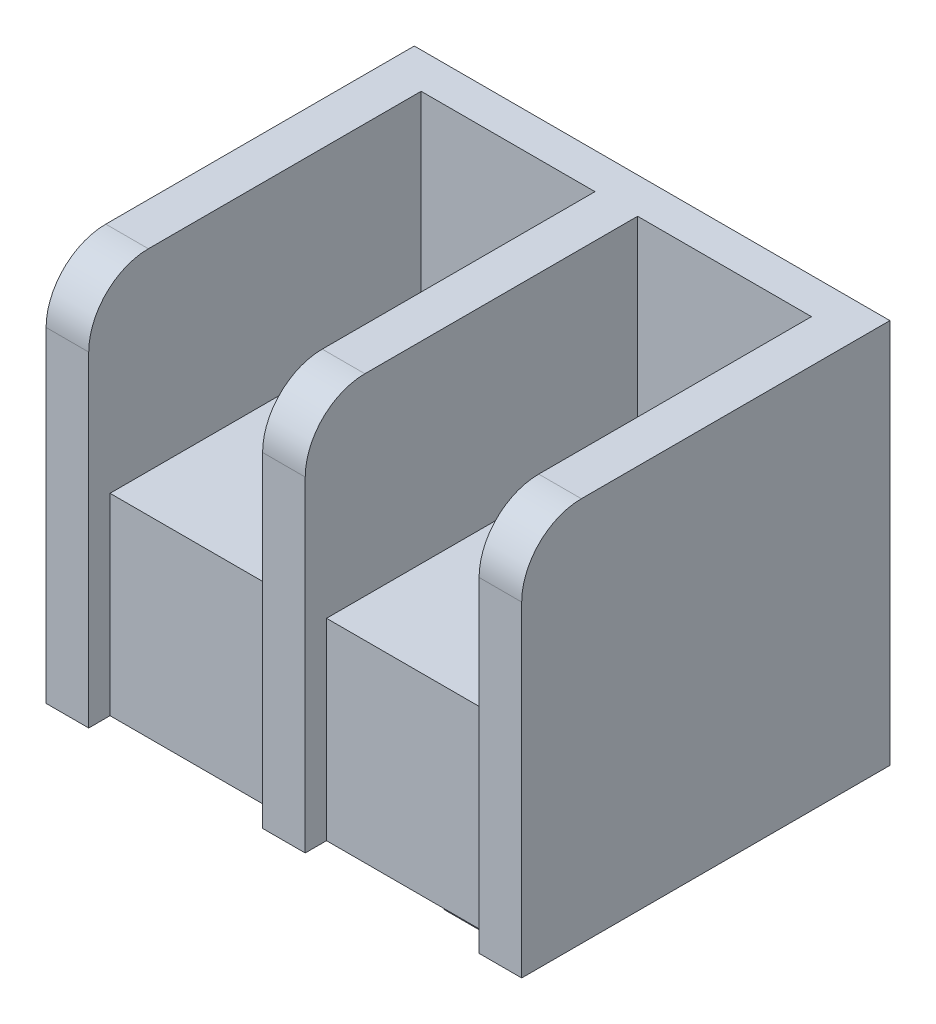
from build123d import *

# Parameters (mm, degrees)
SKETCH1_W              = 27.9
SKETCH1_H              = 21.6
BOSS_EXTRUDE1_DEPTH    = 22.6
SKETCH2_W              = 10.2
SKETCH2_H              = 19.5
CUT_EXTRUDE1_DEPTH     = 11.3
LPATTERN1_COUNT        = 2
LPATTERN1_PITCH        = 12.7
SKETCH4_W              = 3.3
SKETCH4_H              = 1.8
BOSS_EXTRUDE2_DEPTH    = 4
CHAMFER1_SIZE          = 0.5
SKETCH6_W              = 10.2
SKETCH6_H              = 11.3
CUT_EXTRUDE3_DEPTH     = 1.25
LPATTERN2_COUNT        = 2
LPATTERN2_PITCH        = 12.7
SKETCH7_R              = 3.75
BOSS_EXTRUDE3_DEPTH    = 2.5
FILLET1_R              = 1
LPATTERN3_COUNT        = 2
LPATTERN3_PITCH        = 12.7
FILLET1_OF_LPATTERN3_R = 1
FILLET2_R              = 3.5


with BuildPart() as part:
    # Sketch1 → Boss-Extrude1 (new body)
    with BuildSketch(Plane(origin=(0, 0, 0), x_dir=(1, 0, 0), z_dir=(0, 1, 0))):
        Rectangle(SKETCH1_W, SKETCH1_H)
    extrude(amount=BOSS_EXTRUDE1_DEPTH)

    # Sketch2 → Cut-Extrude1 (cut)
    with BuildSketch(Plane(origin=(0, 22.6, 0), x_dir=(1, 0, 0), z_dir=(0, 1, 0))):
        with Locations((-6.35, -1.05)):
            Rectangle(SKETCH2_W, SKETCH2_H)
    cut_extrude1 = extrude(amount=-CUT_EXTRUDE1_DEPTH, mode=Mode.SUBTRACT)

    # LPattern1: Cut-Extrude1 ×2
    with Locations(*[(i * LPATTERN1_PITCH, 0, 0) for i in range(1, LPATTERN1_COUNT)]):
        add(cut_extrude1, mode=Mode.SUBTRACT)

    # Sketch4 → Boss-Extrude2 (add)
    with BuildSketch(Plane(origin=(0, 0, 0), x_dir=(-1, 0, 0), z_dir=(0, -1, 0))):
        with Locations((-6.35, -5.2)):
            Rectangle(SKETCH4_W, SKETCH4_H)
        with Locations((6.35, 7.8)):
            Rectangle(SKETCH4_W, SKETCH4_H)
    extrude(amount=BOSS_EXTRUDE2_DEPTH)

    # Chamfer1
    chamfer1_edges = [part.edges().sort_by_distance(p)[0] for p in [
        (4.7, -4, 5.2),
        (6.35, -4, 4.3),
        (8, -4, 5.2),
        (6.35, -4, 6.1),
        (-8, -4, -7.8),
        (-6.35, -4, -8.7),
        (-4.7, -4, -7.8),
        (-6.35, -4, -6.9),
    ]]
    chamfer(chamfer1_edges, length=CHAMFER1_SIZE)

    # Sketch6 → Cut-Extrude3 (cut)
    with BuildSketch(Plane.XY.offset(10.8)):
        with Locations((-6.35, 5.65)):
            Rectangle(SKETCH6_W, SKETCH6_H)
    cut_extrude3 = extrude(amount=-CUT_EXTRUDE3_DEPTH, mode=Mode.SUBTRACT)

    # LPattern2: Cut-Extrude3 ×2
    with Locations(*[(i * LPATTERN2_PITCH, 0, 0) for i in range(1, LPATTERN2_COUNT)]):
        add(cut_extrude3, mode=Mode.SUBTRACT)

    # Sketch7 → Boss-Extrude3 (add)
    with BuildSketch(Plane(origin=(0, 11.3, 0), x_dir=(1, 0, 0), z_dir=(0, 1, 0))):
        with Locations(Location((-6.35, 1.3, 0), (0, 0, 90))):
            Circle(SKETCH7_R)
    boss_extrude3 = extrude(amount=BOSS_EXTRUDE3_DEPTH)

    # Fillet1
    fillet1_edges = [part.edges().sort_by_distance(p)[0] for p in [
        (-6.35, 13.8, 2.45),
    ]]
    fillet(fillet1_edges, radius=FILLET1_R)

    # LPattern3: Boss-Extrude3 ×2
    with Locations(*[(i * LPATTERN3_PITCH, 0, 0) for i in range(1, LPATTERN3_COUNT)]):
        add(boss_extrude3)

    # Fillet1 of LPattern3
    fillet1_of_lpattern3_edges = [part.edges().sort_by_distance(p)[0] for p in [
        (6.35, 13.8, 2.45),
    ]]
    fillet(fillet1_of_lpattern3_edges, radius=FILLET1_OF_LPATTERN3_R)

    # Fillet2
    fillet2_edges = [part.edges().sort_by_distance(p)[0] for p in [
        (-12.7, 22.6, 10.8),
        (0, 22.6, 10.8),
        (12.7, 22.6, 10.8),
    ]]
    fillet(fillet2_edges, radius=FILLET2_R)


solid = part.part
